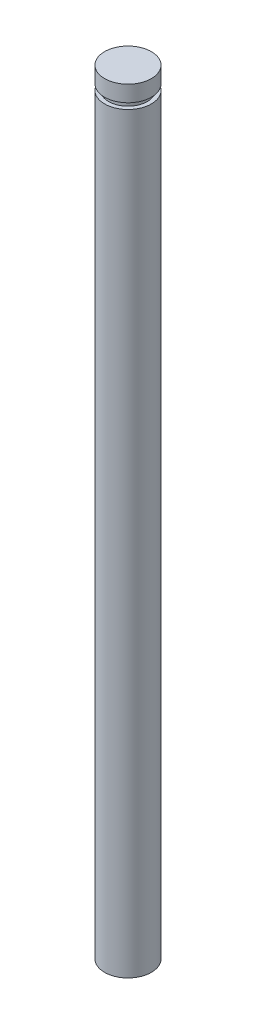
from build123d import *

# Parameters (mm, degrees)
SKETCH1_R           = 0.725
BOSS_EXTRUDE1_DEPTH = 24
CUT_EXTRUDE1_START  = -0.68
SKETCH2_R           = 0.725
SKETCH2_R_2         = 0.6
CUT_EXTRUDE1_DEPTH  = 0.68
BOSS_EXTRUDE2_START = -0.5
SKETCH2_2_R         = 0.725
SKETCH2_2_R_2       = 0.6
BOSS_EXTRUDE2_DEPTH = 0.5


with BuildPart() as part:
    # Sketch1 → Boss-Extrude1 (new body)
    with BuildSketch(Plane(origin=(0, 0, 0), x_dir=(1, 0, 0), z_dir=(0, 1, 0))):
        Circle(SKETCH1_R)
    extrude(amount=BOSS_EXTRUDE1_DEPTH)

    # Sketch2 → Cut-Extrude1 (cut)
    with BuildSketch(Plane(origin=(0, 24, 0), x_dir=(1, 0, 0), z_dir=(0, 1, 0)).offset(CUT_EXTRUDE1_START)):
        Circle(SKETCH2_R)
        Circle(SKETCH2_R_2, mode=Mode.SUBTRACT)
    extrude(amount=CUT_EXTRUDE1_DEPTH, mode=Mode.SUBTRACT)

    # Sketch2<2> → Boss-Extrude2 (add)
    with BuildSketch(Plane(origin=(0, 24, 0), x_dir=(1, 0, 0), z_dir=(0, 1, 0)).offset(BOSS_EXTRUDE2_START)):
        Circle(SKETCH2_2_R)
        Circle(SKETCH2_2_R_2, mode=Mode.SUBTRACT)
    extrude(amount=BOSS_EXTRUDE2_DEPTH)


solid = part.part
